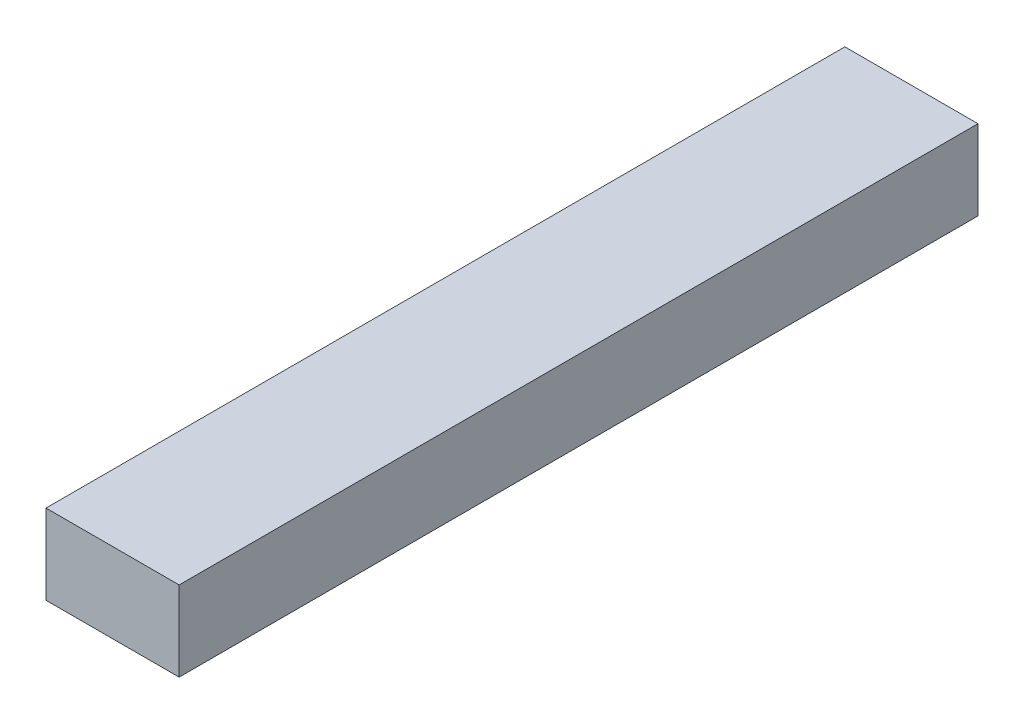
from build123d import *

# Parameters (mm, degrees)
SKETCH1_W           = 50
SKETCH1_H           = 30
BOSS_EXTRUDE1_DEPTH = 300


with BuildPart() as part:
    # Sketch1 → Boss-Extrude1 (new body)
    with BuildSketch(Plane.XY):
        with Locations((-25, 15)):
            Rectangle(SKETCH1_W, SKETCH1_H)
    extrude(amount=BOSS_EXTRUDE1_DEPTH)


solid = part.part
